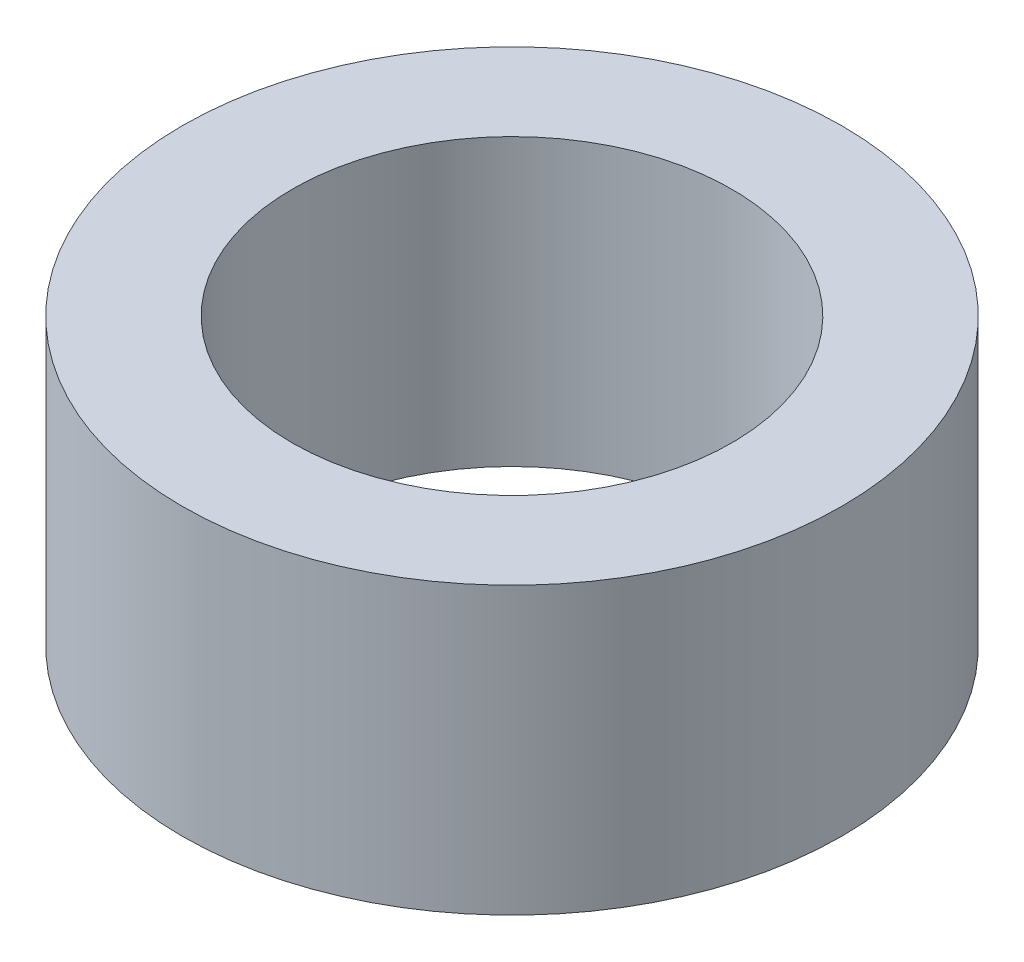
from build123d import *

# Parameters (mm, degrees)
SKETCH_1_R      = 3
SKETCH_1_R_2    = 2
EXTRUDE_1_DEPTH = 2.6


with BuildPart() as part:
    # 草图1 → 凸台-拉伸1 (new body)
    with BuildSketch(Plane(origin=(0, 0, 0), x_dir=(1, 0, 0), z_dir=(0, 1, 0))):
        with Locations(Location((0, 0, 0), (0, 0, 270))):
            Circle(SKETCH_1_R)
        with Locations(Location((0, 0, 0), (0, 0, 270))):
            Circle(SKETCH_1_R_2, mode=Mode.SUBTRACT)
    extrude(amount=EXTRUDE_1_DEPTH)


solid = part.part
